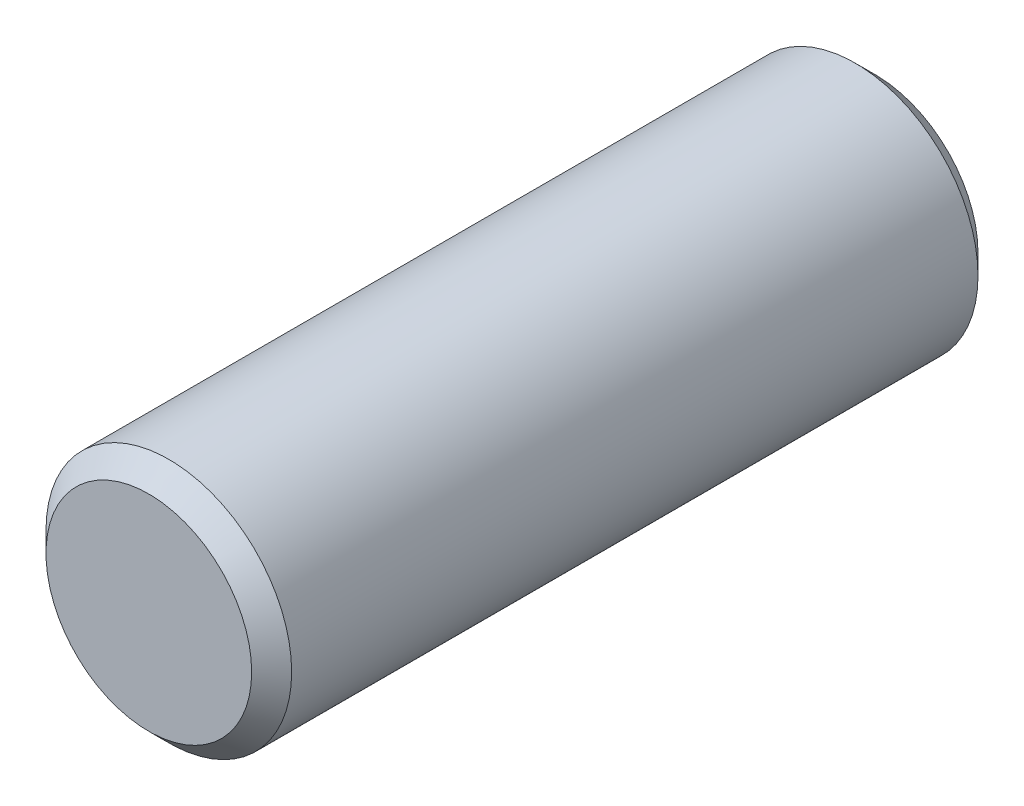
from build123d import *

# Parameters (mm, degrees)
SKETCH1_R      = 3.12
EXTRUDE1_DEPTH = 18.45
CHAMFER1_SIZE  = 0.508


with BuildPart() as part:
    # Sketch1 → Extrude1 (new body)
    with BuildSketch(Plane.XY):
        Circle(SKETCH1_R)
    extrude(amount=EXTRUDE1_DEPTH)

    # Chamfer1
    chamfer1_edges = [part.edges().sort_by_distance(p)[0] for p in [
        (-3.12, 0, 0),
        (-3.12, 0, 18.45),
    ]]
    chamfer(chamfer1_edges, length=CHAMFER1_SIZE)


solid = part.part
